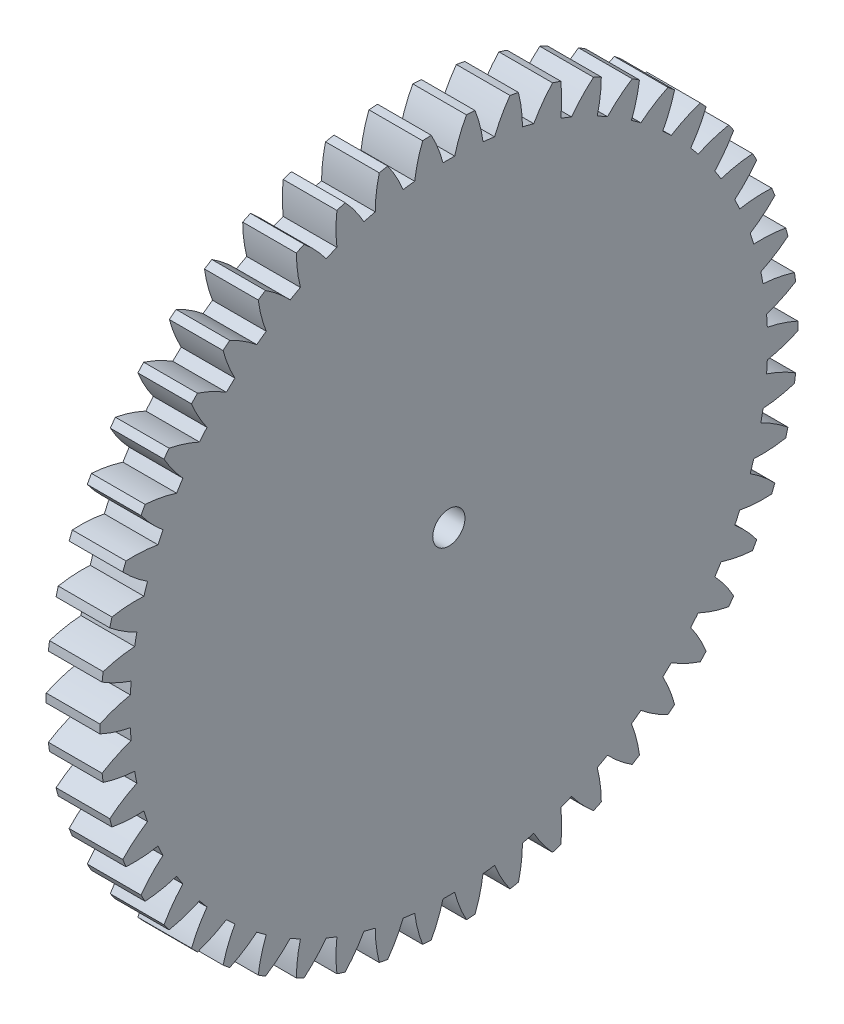
from build123d import *

# Parameters (mm, degrees)
BASPROSKE_W     = 5
BASPROSKE_H     = 32.5
TOOTHCUT_DEPTH  = 47.233105022
TEETHCUTS_COUNT = 50
TEETHCUTS_ANGLE = 352.8
BORSKE_R        = 1.5
BORE_DEPTH      = 50.0000508


with BuildPart() as part:
    # BasProSke → Base-Revolve (revolve)
    with BuildSketch(Plane(origin=(0, 0, 0), x_dir=(1, 0, 0), z_dir=(0, 1, 0)), mode=Mode.PRIVATE) as base_revolve_sk:
        with Locations((2.5, 16.25)):
            Rectangle(BASPROSKE_W, BASPROSKE_H)
    revolve(base_revolve_sk.sketch.rotate(Axis((-10, 0, 0), (1, 0, 0)), 180), axis=Axis((-10, 0, 0), (1, 0, 0)))

    # TooCutSke → ToothCut (cut, through all)
    with BuildSketch(Plane(origin=(0, 0, 0), x_dir=(0, 0, -1), z_dir=(1, 0, 0))):
        with BuildLine():
            ThreePointArc((0.542987455, 29.681533769), (0, 29.6865), (-0.542987455, 29.681533769))
            ThreePointArc((-0.542987455, 29.681533769), (-1.01367548, 31.116033427), (-1.653872687, 32.483324188))
            ThreePointArc((-1.653872687, 32.483324188), (0, 32.5254), (1.653872687, 32.483324188))
            ThreePointArc((1.653872687, 32.483324188), (1.01367548, 31.116033427), (0.542987455, 29.681533769))
        make_face()
    toothcut = extrude(amount=TOOTHCUT_DEPTH, mode=Mode.SUBTRACT)

    # TeethCuts: ToothCut ×50 about axis
    teethcuts_axis = Axis((-10, 0, 0), (1, 0, 0))
    for i in range(1, TEETHCUTS_COUNT):
        add(toothcut.rotate(teethcuts_axis, i * TEETHCUTS_ANGLE / (TEETHCUTS_COUNT - 1)), mode=Mode.SUBTRACT)

    # BorSke → Bore (cut, symmetric)
    with BuildSketch(Plane(origin=(0, 0, 0), x_dir=(0, 0, -1), z_dir=(1, 0, 0))):
        with Locations(Location((0, 0, 0), (0, 0, 180))):
            Circle(BORSKE_R)
    extrude(amount=BORE_DEPTH, both=True, mode=Mode.SUBTRACT)


solid = part.part
